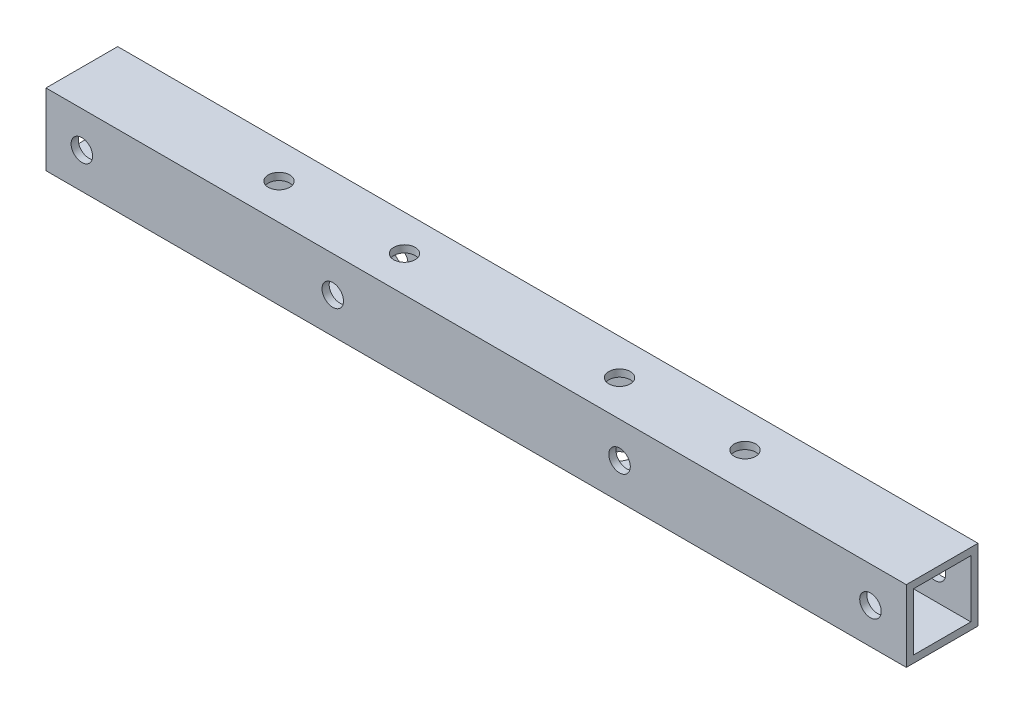
from build123d import *

# Parameters (mm, degrees)
SKETCH_1_W          = 10
SKETCH_1_H          = 10
SKETCH_1_W_2        = 8
SKETCH_1_H_2        = 8
EXTRUDE_1_DEPTH     = 120
SKETCH_2_R          = 1.5
CUT_EXTRUDE_1_DEPTH = 121.519707932
SKETCH_3_R          = 1.5
CUT_EXTRUDE_2_DEPTH = 121.519707932


with BuildPart() as part:
    # ｽｹｯﾁ1 → 押し出し-薄板1 (new body)
    with BuildSketch(Plane(origin=(0, 0, 0), x_dir=(0, 0, -1), z_dir=(1, 0, 0))):
        Rectangle(SKETCH_1_W, SKETCH_1_H)
        Rectangle(SKETCH_1_W_2, SKETCH_1_H_2, mode=Mode.SUBTRACT)
    extrude(amount=EXTRUDE_1_DEPTH)

    # ｽｹｯﾁ2 → ｶｯﾄ - 押し出し1 (cut, through all)
    with BuildSketch(Plane.XY.offset(5)):
        with Locations((5, 0)):
            Circle(SKETCH_2_R)
        with Locations(Location((115, 0, 0), (0, 0, 180))):
            Circle(SKETCH_2_R)
        with Locations((40, 0)):
            Circle(SKETCH_2_R)
        with Locations(Location((80, 0, 0), (0, 0, 180))):
            Circle(SKETCH_2_R)
    extrude(amount=-CUT_EXTRUDE_1_DEPTH, mode=Mode.SUBTRACT)

    # ｽｹｯﾁ3 → ｶｯﾄ - 押し出し2 (cut, through all)
    with BuildSketch(Plane(origin=(0, 5, 0), x_dir=(1, 0, 0), z_dir=(0, 1, 0))):
        with Locations(Location((45, 0, 0), (0, 0, 270))):
            Circle(SKETCH_3_R)
        with Locations(Location((75, 0, 0), (0, 0, 270))):
            Circle(SKETCH_3_R)
        with Locations(Location((27.5, 0, 0), (0, 0, 270))):
            Circle(SKETCH_3_R)
        with Locations(Location((92.5, 0, 0), (0, 0, 270))):
            Circle(SKETCH_3_R)
    extrude(amount=-CUT_EXTRUDE_2_DEPTH, mode=Mode.SUBTRACT)


solid = part.part
